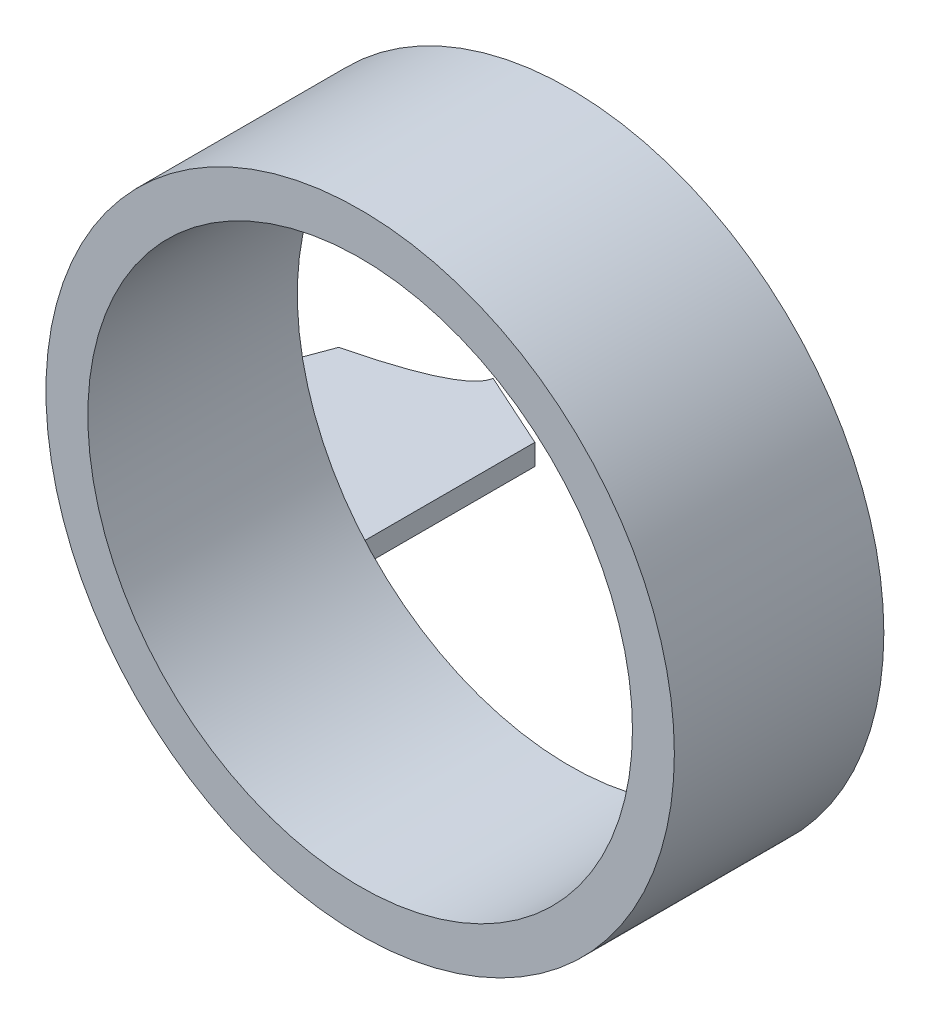
from build123d import *

# Parameters (mm, degrees)
BOSS_EXTRUDE1_DEPTH      = 10
BOSS_EXTRUDE1_DEPTH_BACK = 10
SKETCH1_R                = 30
CUT_EXTRUDE1_DEPTH       = 10
CUT_EXTRUDE1_DEPTH_BACK  = 20
SKETCH2_R                = 26
BOSS_EXTRUDE3_DEPTH      = 2


with BuildPart() as part:
    # Sketch1 → Boss-Extrude1 (new, two sides: drawn at the far end of the back side and taken through both)
    with BuildSketch(Plane.XY.offset(-BOSS_EXTRUDE1_DEPTH_BACK)):
        Circle(SKETCH1_R)
    extrude(amount=BOSS_EXTRUDE1_DEPTH + BOSS_EXTRUDE1_DEPTH_BACK)

    # Sketch2 → Cut-Extrude1 (cut, two sides: drawn at the far end of the back side and taken through both)
    with BuildSketch(Plane.XY.offset(10).offset(-CUT_EXTRUDE1_DEPTH_BACK)):
        Circle(SKETCH2_R)
    extrude(amount=CUT_EXTRUDE1_DEPTH + CUT_EXTRUDE1_DEPTH_BACK, mode=Mode.SUBTRACT)


with BuildPart() as body_2:
    # Sketch7 → Boss-Extrude3 (new body)
    with BuildSketch(Plane(origin=(0, -20, 0), x_dir=(1, 0, 0), z_dir=(0, 1, 0))):
        with BuildLine():
            Line((-29.69800601, 7.788714547), (-22.41056436, 11.089198481))
            Line((-22.41056436, 11.089198481), (-22.41056436, 29.089198481))
            Line((-22.41056436, 29.089198481), (-29.69800601, 32.389682416))
            add(Edge.make_bspline(
                [(-39.626682179, 27.589198481), (-30.054776841, 29.930559954), (-29.69800601, 32.389682416)],
                knots=[0, 0, 0, 1, 1, 1], degree=2))
            Line((-39.626682179, 27.589198481), (-42.41056436, 20.089198481))
            Line((-42.41056436, 20.089198481), (-39.626682179, 12.589198481))
            add(Edge.make_bspline(
                [(-39.626682179, 12.589198481), (-30.054776841, 10.247837009), (-29.69800601, 7.788714547)],
                knots=[0, 0, 0, 1, 1, 1], degree=2))
        make_face()
    extrude(amount=-BOSS_EXTRUDE3_DEPTH)


solid = Compound([part.part, body_2.part])
